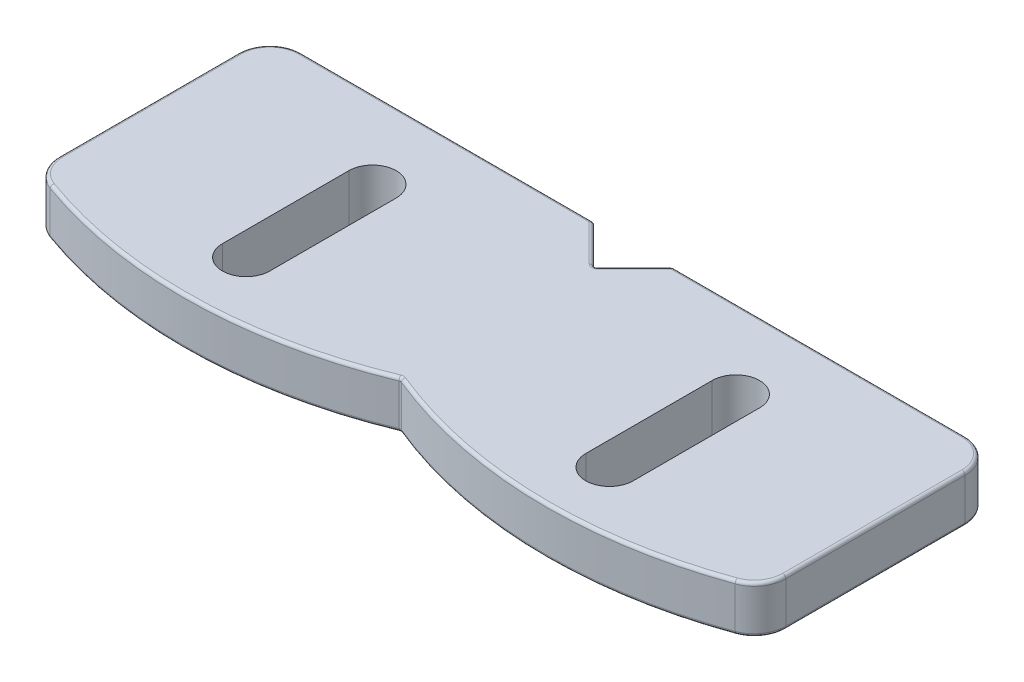
from build123d import *

# Parameters (mm, degrees)
BOSS_EXTRUDE1_DEPTH = 3
FILLET1_R           = 0.2


with BuildPart() as part:
    # Sketch1 → Boss-Extrude1 (new body)
    with BuildSketch(Plane(origin=(0, 0, 0), x_dir=(1, 0, 0), z_dir=(0, 1, 0))):
        with BuildLine():
            Line((-2.5, 17), (-21, 17))
            ThreePointArc((-21, 17), (-22.414213562, 16.414213562), (-23, 15))
            Line((-23, 15), (-23, 3.660865618))
            ThreePointArc((-23, 3.660865618), (-22.636634177, 2.511331551), (-21.678571429, 1.779498876))
            ThreePointArc((-21.678571429, 1.779498876), (-10.791388434, 0.008370007), (0, 2.291697995))
            ThreePointArc((0, 2.291697995), (10.791388434, 0.008370007), (21.678571429, 1.779498876))
            ThreePointArc((21.678571429, 1.779498876), (22.636634177, 2.511331551), (23, 3.660865618))
            Line((23, 3.660865618), (23, 15))
            ThreePointArc((23, 15), (22.414213562, 16.414213562), (21, 17))
            Line((21, 17), (2.5, 17))
            Line((2.5, 17), (0, 14.5))
            Line((0, 14.5), (-2.5, 17))
        make_face()
        with BuildLine():
            Line((-10, 12), (-10, 4))
            ThreePointArc((-10, 4), (-11.5, 2.5), (-13, 4))
            Line((-13, 4), (-13, 12))
            ThreePointArc((-13, 12), (-11.5, 13.5), (-10, 12))
        make_face(mode=Mode.SUBTRACT)
        with BuildLine():
            Line((10, 12), (10, 4))
            ThreePointArc((10, 4), (11.5, 2.5), (13, 4))
            Line((13, 4), (13, 12))
            ThreePointArc((13, 12), (11.5, 13.5), (10, 12))
        make_face(mode=Mode.SUBTRACT)
    extrude(amount=BOSS_EXTRUDE1_DEPTH)

    # Fillet1
    fillet1_edges = [part.edges().sort_by_distance(p)[0] for p in [
        (-22.414213562, 3, -16.414213562),
        (1.25, 0, -15.75),
        (11.75, 0, -17),
        (22.414213562, 0, -16.414213562),
        (23, 0, -9.330432809),
        (22.636634177, 0, -2.511331551),
        (10.791388434, 0, -0.008370007),
        (-23, 3, -9.330432809),
        (-10.791388434, 0, -0.008370007),
        (-22.636634177, 0, -2.511331551),
        (-23, 0, -9.330432809),
        (-22.414213562, 0, -16.414213562),
        (-11.75, 0, -17),
        (-1.25, 0, -15.75),
        (-22.636634177, 3, -2.511331551),
        (-10.791388434, 3, -0.008370007),
        (0, 1.5, -14.5),
        (2.5, 1.5, -17),
        (0, 1.5, -2.291697995),
        (-2.5, 1.5, -17),
        (10.791388434, 3, -0.008370007),
        (22.636634177, 3, -2.511331551),
        (23, 3, -9.330432809),
        (22.414213562, 3, -16.414213562),
        (11.75, 3, -17),
        (1.25, 3, -15.75),
        (-1.25, 3, -15.75),
        (-11.75, 3, -17),
    ]]
    fillet(fillet1_edges, radius=FILLET1_R)


solid = part.part
